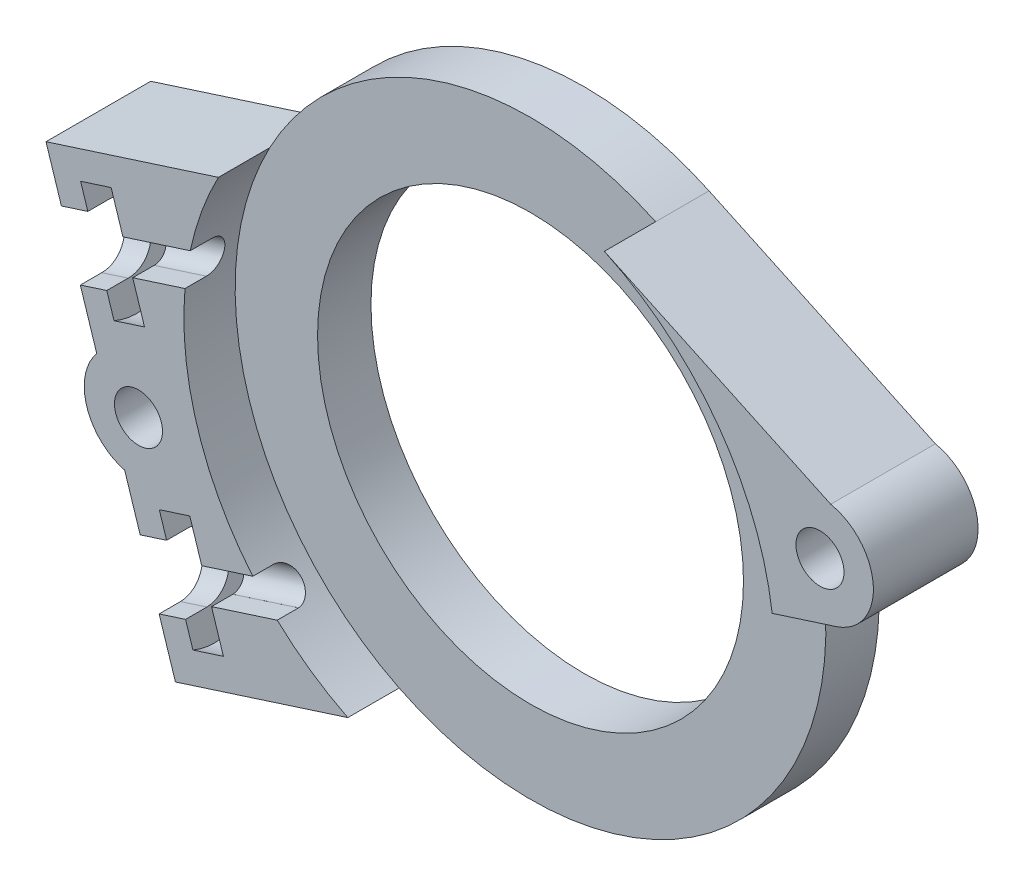
from build123d import *

# Parameters (mm, degrees)
CROQUIS1_R              = 27.65
SALIENTE_EXTRUIR1_DEPTH = 5
CROQUIS2_R              = 2.25
SALIENTE_EXTRUIR2_DEPTH = 9.8
CROQUIS8_R              = 19.936300619
CORTAR_EXTRUIR8_DEPTH   = 52.356476321
CHAFL_N1_SIZE           = 1
CROQUIS14_R             = 2.9
CORTAR_EXTRUIR15_DEPTH  = 3
CROQUIS15_R             = 5.5
CORTAR_EXTRUIR16_DEPTH  = 3
CROQUIS16_R             = 1.5
CORTAR_EXTRUIR17_DEPTH  = 25
CROQUIS18_R             = 2.9
CORTAR_EXTRUIR18_DEPTH  = 3
CROQUIS19_R             = 5.5
CORTAR_EXTRUIR19_DEPTH  = 3
CROQUIS20_R             = 1.5
CORTAR_EXTRUIR20_DEPTH  = 22
CORTAR_EXTRUIR21_START  = -2
CORTAR_EXTRUIR21_DEPTH  = 2


with BuildPart() as part:
    # Croquis1 → Saliente-Extruir1 (new body)
    with BuildSketch(Plane.XY):
        Circle(CROQUIS1_R)
    extrude(amount=SALIENTE_EXTRUIR1_DEPTH)

    # Croquis2 → Saliente-Extruir2 (add)
    # profile 1 of 2: a face of its own
    with BuildSketch(Plane(origin=(0, 0, 0), x_dir=(-1, 0, 0), z_dir=(0, 0, -1))):
        with BuildLine():
            ThreePointArc((-32.903550176, 15.136150236), (-36.88979451, 10.508157001), (-33.425205403, 5.477740757))
            Line((-33.425205403, 5.477740757), (-27.421093943, 3.550507988))
            ThreePointArc((-27.421093943, 3.550507988), (-22.324820018, 16.313335379), (-11.713593891, 25.046241598))
            Line((-11.713593891, 25.046241598), (-32.903550176, 15.136150236))
        make_face()
        with Locations((-31.89707142, 10.238497685)):
            Circle(CROQUIS2_R, mode=Mode.SUBTRACT)
    # profile 2 of 2: a face of its own
    with BuildSketch(Plane(origin=(0, 0, 0), x_dir=(-1, 0, 0), z_dir=(0, 0, -1))):
        with BuildLine():
            ThreePointArc((27.65, 0), (23.501050206, -14.567880396), (12.299320852, -24.763868974))
            Line((12.299320852, -24.763868974), (28.440475678, -29.944945762))
            Line((28.440475678, -29.944945762), (30.192362506, -24.487108002))
            Line((30.192362506, -24.487108002), (33.190053815, -15.148084182))
            ThreePointArc((33.190053815, -15.148084182), (36.731135944, -11.790162344), (35.805913272, -6.998621389))
            Line((35.805913272, -6.998621389), (38.863217361, 2.52612041))
            Line((38.863217361, 2.52612041), (40.555491409, 7.798240191))
            Line((40.555491409, 7.798240191), (24.414336583, 12.979316979))
            ThreePointArc((24.414336583, 12.979316979), (26.828892136, 6.688276814), (27.65, 0))
        make_face()
        with Locations((31.89707142, -10.238497685)):
            Circle(CROQUIS2_R, mode=Mode.SUBTRACT)
    extrude(amount=-SALIENTE_EXTRUIR2_DEPTH)

    # Croquis8 → Cortar-Extruir8 (cut, through all)
    with BuildSketch(Plane(origin=(0, 0, 0), x_dir=(-1, 0, 0), z_dir=(0, 0, -1))):
        Circle(CROQUIS8_R)
    extrude(amount=-CORTAR_EXTRUIR8_DEPTH, mode=Mode.SUBTRACT)

    # Chaflán1
    chafl_n1_edges = [part.edges().sort_by_distance(p)[0] for p in [
        (-29.64707142, -10.238497685, 0),
        (34.14707142, 10.238497685, 0),
    ]]
    chamfer(chafl_n1_edges, length=CHAFL_N1_SIZE)

    # Croquis14 → Cortar-Extruir15 (cut)
    with BuildSketch(Plane(origin=(-34.497983543, -11.073352785, 0), x_dir=(0, 0, -1), z_dir=(0.9521513856630914, 0.30562679656707925, 0))):
        with Locations((-7.77864737, 12.203434568)):
            Circle(CROQUIS14_R)
    extrude(amount=CORTAR_EXTRUIR15_DEPTH, mode=Mode.SUBTRACT)

    # Croquis15 → Cortar-Extruir16 (cut)
    with BuildSketch(Plane(origin=(-32.022389941, -10.278723114, 0), x_dir=(0, 0, 1), z_dir=(-0.9521513856630914, -0.30562679656707925, 0))):
        with Locations((7.77864737, 12.203434568)):
            Circle(CROQUIS15_R)
    extrude(amount=-CORTAR_EXTRUIR16_DEPTH, mode=Mode.SUBTRACT)

    # Croquis16 → Cortar-Extruir17 (cut)
    with BuildSketch(Plane(origin=(-29.546796338, -9.484093443, 0), x_dir=(0, 0, -1), z_dir=(0.9521513856630914, 0.30562679656707925, 0))):
        with Locations(Location((-7.77864737, 12.203434568, 0), (0, 0, 270))):
            Circle(CROQUIS16_R)
    extrude(amount=CORTAR_EXTRUIR17_DEPTH, mode=Mode.SUBTRACT)

    # Croquis18 → Cortar-Extruir18 (cut)
    with BuildSketch(Plane(origin=(-34.497983543, -11.073352785, 0), x_dir=(0, 0, -1), z_dir=(0.9521513856630915, 0.30562679656707936, 0))):
        with Locations((-7.867235226, -11.925798003)):
            Circle(CROQUIS18_R)
    extrude(amount=CORTAR_EXTRUIR18_DEPTH, mode=Mode.SUBTRACT)

    # Croquis19 → Cortar-Extruir19 (cut)
    with BuildSketch(Plane(origin=(-32.022389941, -10.278723114, 0), x_dir=(0, 0, 1), z_dir=(-0.9521513856630915, -0.30562679656707936, 0))):
        with Locations((7.867235226, -11.925798003)):
            Circle(CROQUIS19_R)
    extrude(amount=-CORTAR_EXTRUIR19_DEPTH, mode=Mode.SUBTRACT)

    # Croquis20 → Cortar-Extruir20 (cut)
    with BuildSketch(Plane(origin=(-29.546796338, -9.484093443, 0), x_dir=(0, 0, -1), z_dir=(0.9521513856630915, 0.30562679656707936, 0))):
        with Locations(Location((-7.867235226, -11.925798003, 0), (0, 0, 270))):
            Circle(CROQUIS20_R)
    extrude(amount=CORTAR_EXTRUIR20_DEPTH, mode=Mode.SUBTRACT)

    # Croquis21 → Cortar-Extruir21 (cut)
    with BuildSketch(Plane.XY.offset(9.8).offset(CORTAR_EXTRUIR21_START)):
        with BuildLine():
            Line((-25.979532538, -19.288780739), (-25.062652149, -22.145234896))
            Line((-25.062652149, -22.145234896), (-18.911821549, -20.170907409))
            ThreePointArc((-18.911821549, -20.170907409), (-20.090955919, -18.996736306), (-21.19732255, -17.753760635))
            Line((-21.19732255, -17.753760635), (-25.979532538, -19.288780739))
        make_face()
        with BuildLine():
            Line((-33.354072593, 3.685901488), (-32.437192203, 0.829447331))
            Line((-32.437192203, 0.829447331), (-27.545683066, 2.399550877))
            ThreePointArc((-27.545683066, 2.399550877), (-27.350119986, 4.061211244), (-27.05441226, 5.708001162))
            Line((-27.05441226, 5.708001162), (-33.354072593, 3.685901488))
        make_face()
        Polygon((-39.113997867, 3.307403367), (-37.341362447, -2.21507467), (-34.865768845, -1.420444999), (-36.638404265, 4.102033038), align=None)
        Polygon((-31.739457813, -19.66727886), (-29.966822393, -25.189756897), (-27.491228791, -24.395127226), (-29.263864211, -18.872649189), align=None)
    extrude(amount=CORTAR_EXTRUIR21_DEPTH, mode=Mode.SUBTRACT)


solid = part.part
